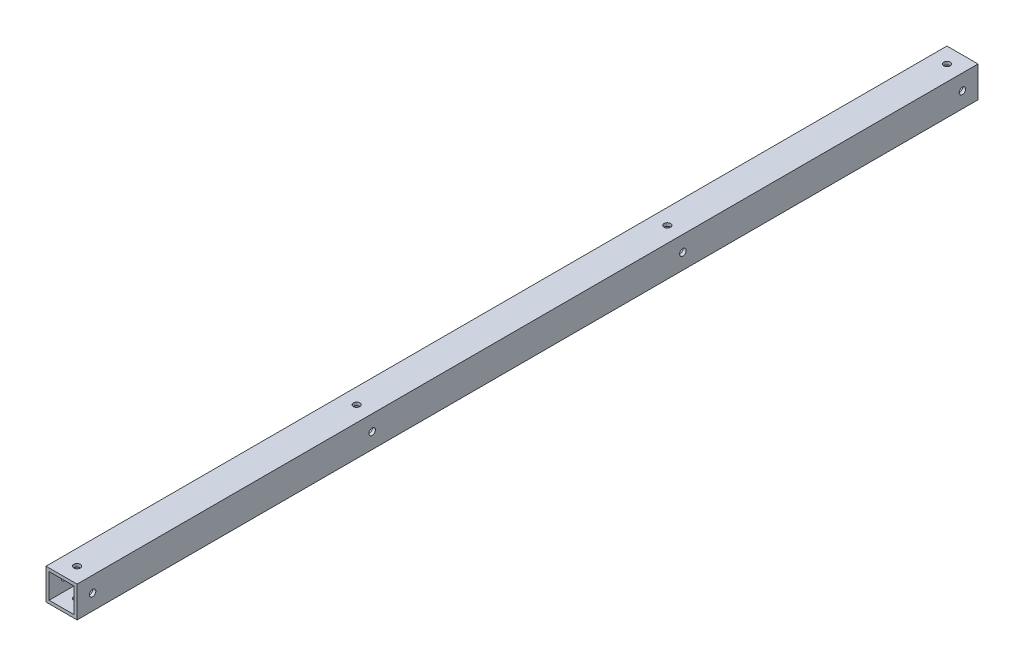
from build123d import *

# Parameters (mm, degrees)
SKETCH_1_W          = 20
SKETCH_1_H          = 20
SKETCH_1_W_2        = 16
SKETCH_1_H_2        = 16
EXTRUDE_1_DEPTH     = 580
SKETCH_2_R          = 2.1
CUT_EXTRUDE_1_DEPTH = 20
SKETCH_3_R          = 2.1
CUT_EXTRUDE_2_DEPTH = 581.689245638


with BuildPart() as part:
    # 草图1 → 凸台-拉伸1 (new body)
    with BuildSketch(Plane.XY):
        Rectangle(SKETCH_1_W, SKETCH_1_H)
        Rectangle(SKETCH_1_W_2, SKETCH_1_H_2, mode=Mode.SUBTRACT)
    extrude(amount=EXTRUDE_1_DEPTH)

    # 草图2 → 切除-拉伸1 (cut)
    with BuildSketch(Plane(origin=(0, 10, 0), x_dir=(1, 0, 0), z_dir=(0, 1, 0))):
        with Locations(Location((0, -10, 0), (0, 0, 270))):
            Circle(SKETCH_2_R)
        with Locations(Location((0, -190, 0), (0, 0, 270))):
            Circle(SKETCH_2_R)
    cut_extrude_1 = extrude(amount=-CUT_EXTRUDE_1_DEPTH, mode=Mode.SUBTRACT)

    # 镜向1: 切除-拉伸1 across plane
    add(cut_extrude_1.mirror(Plane.XY.offset(290)), mode=Mode.SUBTRACT)

    # 草图3 → 切除-拉伸2 (cut, through all)
    with BuildSketch(Plane(origin=(10, 10, 580), x_dir=(0, 0, -1), z_dir=(1, 0, 0))):
        with Locations((10, -10)):
            Circle(SKETCH_3_R)
        with Locations((570, -10)):
            Circle(SKETCH_3_R)
        with Locations((190, -10)):
            Circle(SKETCH_3_R)
        with Locations(Location((390, -10, 0), (0, 0, 180))):
            Circle(SKETCH_3_R)
    extrude(amount=-CUT_EXTRUDE_2_DEPTH, mode=Mode.SUBTRACT)


solid = part.part
